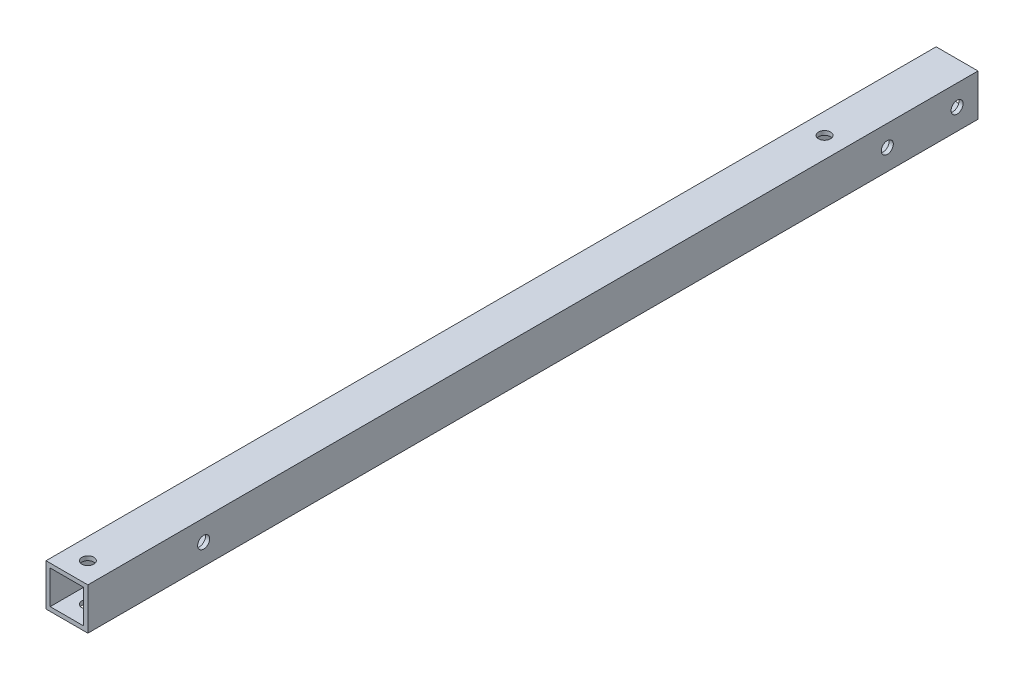
from build123d import *

# Parameters (mm, degrees)
SKETCH_1_W          = 15
SKETCH_1_H          = 15
SKETCH_1_W_2        = 12
SKETCH_1_H_2        = 12
EXTRUDE_1_DEPTH     = 319
SKETCH_2_R          = 2.15
CUT_EXTRUDE_1_DEPTH = 320.440526546
SKETCH_3_R          = 2.15
CUT_EXTRUDE_2_DEPTH = 320.440526546


with BuildPart() as part:
    # ｽｹｯﾁ1 → 押し出し-薄板1 (new body)
    with BuildSketch(Plane.XY):
        Rectangle(SKETCH_1_W, SKETCH_1_H)
        Rectangle(SKETCH_1_W_2, SKETCH_1_H_2, mode=Mode.SUBTRACT)
    extrude(amount=EXTRUDE_1_DEPTH)

    # ｽｹｯﾁ2 → ｶｯﾄ - 押し出し1 (cut, through all)
    with BuildSketch(Plane(origin=(0, 7.5, 0), x_dir=(1, 0, 0), z_dir=(0, 1, 0))):
        with Locations(Location((0, -47.5, 0), (0, 0, 180))):
            Circle(SKETCH_2_R)
        with Locations(Location((0, -311.5, 0), (0, 0, 180))):
            Circle(SKETCH_2_R)
    extrude(amount=-CUT_EXTRUDE_1_DEPTH, mode=Mode.SUBTRACT)

    # ｽｹｯﾁ3 → ｶｯﾄ - 押し出し2 (cut, through all)
    with BuildSketch(Plane(origin=(7.5, 0, 0), x_dir=(0, 0, -1), z_dir=(1, 0, 0))):
        with Locations(Location((-32.5, 0, 0), (0, 0, 90))):
            Circle(SKETCH_3_R)
        with Locations(Location((-7.5, 0, 0), (0, 0, 90))):
            Circle(SKETCH_3_R)
        with Locations(Location((-277.5, 0, 0), (0, 0, 90))):
            Circle(SKETCH_3_R)
    extrude(amount=-CUT_EXTRUDE_2_DEPTH, mode=Mode.SUBTRACT)


solid = part.part
